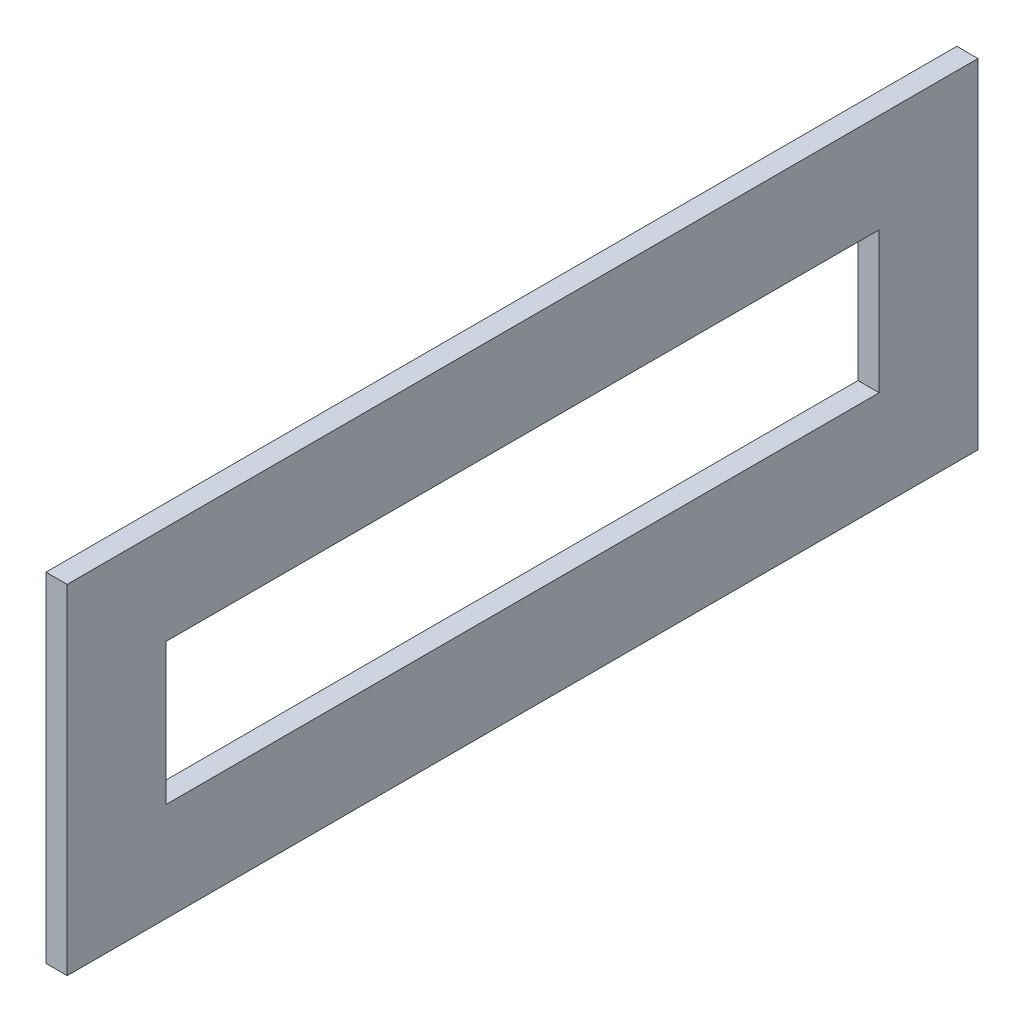
from build123d import *

# Parameters (mm, degrees)
SKETCH1_W           = 129
SKETCH1_H           = 48
SKETCH1_W_2         = 101
SKETCH1_H_2         = 20
BOSS_EXTRUDE1_DEPTH = 3


with BuildPart() as part:
    # Sketch1 → Boss-Extrude1 (new body)
    with BuildSketch(Plane(origin=(0, 0, 0), x_dir=(0, 0, -1), z_dir=(1, 0, 0))):
        with Locations((0, 51.123529412)):
            Rectangle(SKETCH1_W, SKETCH1_H)
        with Locations((0, 51.123529412)):
            Rectangle(SKETCH1_W_2, SKETCH1_H_2, mode=Mode.SUBTRACT)
    extrude(amount=BOSS_EXTRUDE1_DEPTH)


solid = part.part
